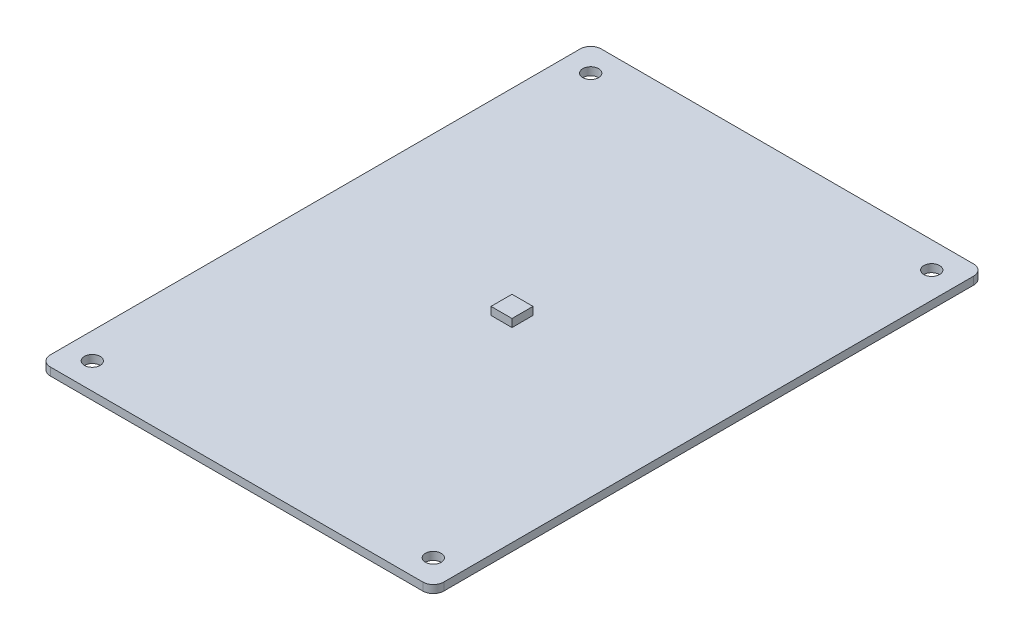
from build123d import *

# Parameters (mm, degrees)
ESQUISSE1_R        = 1.5
BOSS_EXTRU_1_DEPTH = 1.5
ESQUISSE2_W        = 4
ESQUISSE2_H        = 4
BOSS_EXTRU_2_DEPTH = 1.5


with BuildPart() as part:
    # Esquisse1 → Boss.-Extru.1 (new body)
    with BuildSketch(Plane(origin=(0, 0, 0), x_dir=(1, 0, 0), z_dir=(0, 1, 0))):
        with BuildLine():
            Line((-29.485849057, 82.95990566), (41.514150943, 82.95990566))
            ThreePointArc((41.514150943, 82.95990566), (42.928364506, 82.374119223), (43.514150943, 80.95990566))
            Line((43.514150943, 80.95990566), (43.514150943, -20.04009434))
            ThreePointArc((43.514150943, -20.04009434), (42.928364506, -21.454307902), (41.514150943, -22.04009434))
            Line((41.514150943, -22.04009434), (-29.485849057, -22.04009434))
            ThreePointArc((-29.485849057, -22.04009434), (-30.900062619, -21.454307902), (-31.485849057, -20.04009434))
            Line((-31.485849057, -20.04009434), (-31.485849057, 80.95990566))
            ThreePointArc((-31.485849057, 80.95990566), (-30.900062619, 82.374119223), (-29.485849057, 82.95990566))
        make_face()
        with Locations(Location((38.514150943, 77.95990566, 0), (0, 0, 270))):
            Circle(ESQUISSE1_R, mode=Mode.SUBTRACT)
        with Locations(Location((38.514150943, -17.04009434, 0), (0, 0, 270))):
            Circle(ESQUISSE1_R, mode=Mode.SUBTRACT)
        with Locations(Location((-26.485849057, -17.04009434, 0), (0, 0, 270))):
            Circle(ESQUISSE1_R, mode=Mode.SUBTRACT)
        with Locations(Location((-26.485849057, 77.95990566, 0), (0, 0, 270))):
            Circle(ESQUISSE1_R, mode=Mode.SUBTRACT)
    extrude(amount=BOSS_EXTRU_1_DEPTH)

    # Esquisse2 → Boss.-Extru.2 (add)
    with BuildSketch(Plane(origin=(0, 1.5, 0), x_dir=(1, 0, 0), z_dir=(0, 1, 0))):
        with Locations((6.014150943, 30.45990566)):
            Rectangle(ESQUISSE2_W, ESQUISSE2_H)
    extrude(amount=BOSS_EXTRU_2_DEPTH)


solid = part.part
